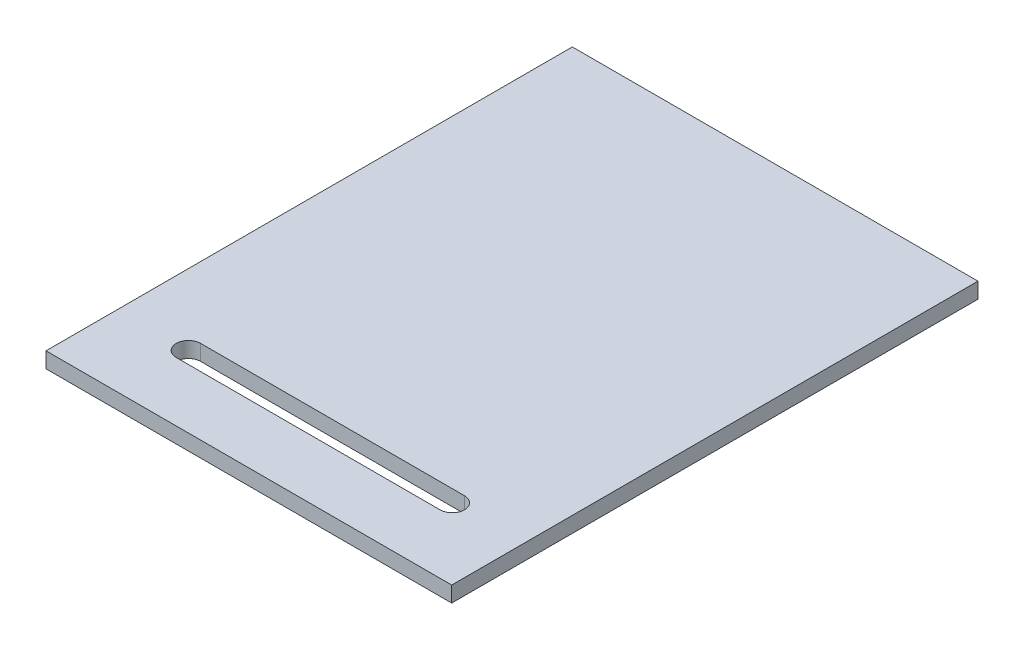
from build123d import *

# Parameters (mm, degrees)
SKIZZE1_W                       = 41.517188714
SKIZZE1_H                       = 53.860351018
AUFSATZ_LINEAR_AUSTRAGEN1_DEPTH = 1.6


with BuildPart() as part:
    # Skizze1 → Aufsatz-Linear austragen1 (new body)
    with BuildSketch(Plane(origin=(0, 0, 0), x_dir=(1, 0, 0), z_dir=(0, 1, 0))):
        Rectangle(SKIZZE1_W, SKIZZE1_H)
        with BuildLine():
            ThreePointArc((-13.5, -18.360991054), (-14.75, -19.610991054), (-13.5, -20.860991054))
            Line((-13.5, -20.860991054), (13.5, -20.860991054))
            ThreePointArc((13.5, -20.860991054), (14.75, -19.610991054), (13.5, -18.360991054))
            Line((13.5, -18.360991054), (-13.5, -18.360991054))
        make_face(mode=Mode.SUBTRACT)
    extrude(amount=AUFSATZ_LINEAR_AUSTRAGEN1_DEPTH)


solid = part.part
